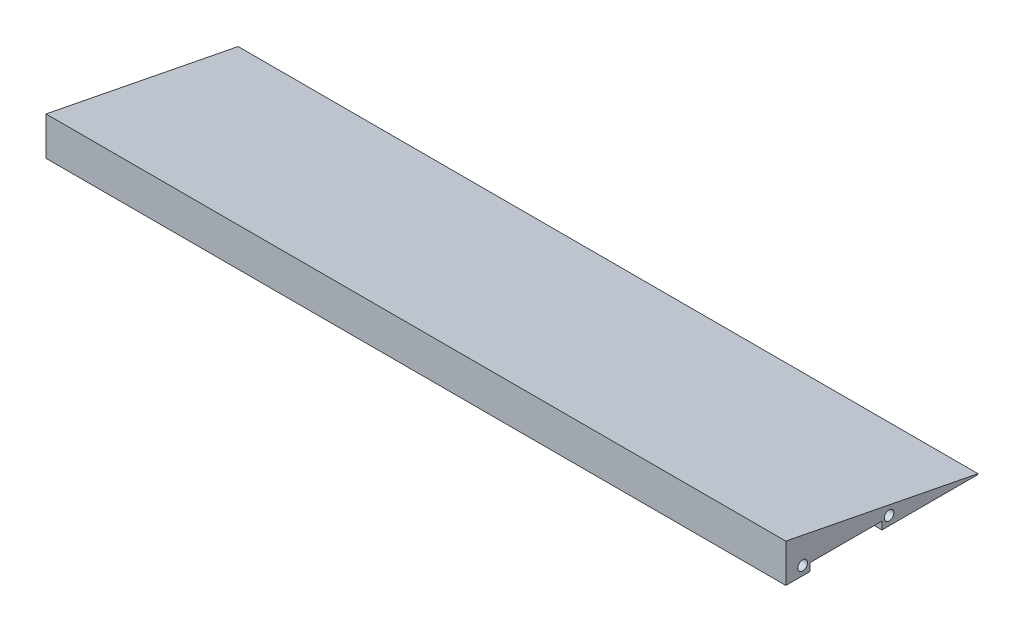
from build123d import *

# Parameters (mm, degrees)
BOSS_EXTRUDE1_DEPTH = 195.58
SKETCH2_R           = 2.5527
CUT_EXTRUDE1_DEPTH  = 38.1
SKETCH3_W           = 38.1
SKETCH3_H           = 4.064
CUT_EXTRUDE2_DEPTH  = 405.649982083
CUT_EXTRUDE3_DEPTH  = 4.064


with BuildPart() as part:
    # Sketch1 → Boss-Extrude1 (new, symmetric)
    with BuildSketch(Plane(origin=(0, 0, 0), x_dir=(0, 0, -1), z_dir=(1, 0, 0))):
        Polygon((0, 0), (0, 20.32), (101.6, 0.4), (101.6, 0), align=None)
    extrude(amount=BOSS_EXTRUDE1_DEPTH, both=True)

    # Sketch2 → Cut-Extrude1 (cut)
    with BuildSketch(Plane(origin=(195.58, 0, 0), x_dir=(0, 0, -1), z_dir=(1, 0, 0))):
        with Locations((8.876362872, 4.7625)):
            Circle(SKETCH2_R)
        with Locations((54.596362872, 4.7625)):
            Circle(SKETCH2_R)
    cut_extrude1 = extrude(amount=-CUT_EXTRUDE1_DEPTH, mode=Mode.SUBTRACT)

    # Mirror3: Cut-Extrude1 across plane
    add(cut_extrude1.mirror(Plane(origin=(0, 0, 0), x_dir=(0, 0, 1), z_dir=(1, 0, 0))), mode=Mode.SUBTRACT)

    # Sketch3 → Cut-Extrude2 (cut, through all)
    with BuildSketch(Plane.ZY.offset(195.58)):
        with Locations((-31.75, 2.032)):
            Rectangle(SKETCH3_W, SKETCH3_H)
    extrude(amount=-CUT_EXTRUDE2_DEPTH, mode=Mode.SUBTRACT)

    # Sketch4 → Cut-Extrude3 (cut)
    with BuildSketch(Plane.XZ):
        Polygon((-144.78, -50.8), (-146.105623787, -60.232303355), (-144.78, -60.232303355), (-128.381247573, -60.232303355), (-127.055623787, -60.232303355), (-128.381247573, -50.8), align=None)
        Polygon((-77.581247573, -50.8), (-78.90687136, -60.232303355), (-77.581247573, -60.232303355), (-61.182495147, -60.232303355), (-59.85687136, -60.232303355), (-61.182495147, -50.8), align=None)
        Polygon((-10.382495147, -50.8), (-11.708118933, -60.232303355), (-10.382495147, -60.232303355), (6.01625728, -60.232303355), (7.341881067, -60.232303355), (6.01625728, -50.8), align=None)
        Polygon((56.81625728, -50.8), (55.490633493, -60.232303355), (56.81625728, -60.232303355), (73.215009707, -60.232303355), (74.540633493, -60.232303355), (73.215009707, -50.8), align=None)
        Polygon((124.015009707, -50.8), (122.68938592, -60.232303355), (124.015009707, -60.232303355), (140.413762134, -60.232303355), (141.73938592, -60.232303355), (140.413762134, -50.8), align=None)
        Polygon((124.015009707, -12.7), (140.413762134, -12.7), (141.73938592, -3.267696645), (140.413762134, -3.267696645), (124.015009707, -3.267696645), (122.68938592, -3.267696645), align=None)
        Polygon((56.81625728, -12.7), (73.215009707, -12.7), (74.540633493, -3.267696645), (73.215009707, -3.267696645), (56.81625728, -3.267696645), (55.490633493, -3.267696645), align=None)
        Polygon((-10.382495147, -12.7), (6.01625728, -12.7), (7.341881067, -3.267696645), (6.01625728, -3.267696645), (-10.382495147, -3.267696645), (-11.708118933, -3.267696645), align=None)
        Polygon((-77.581247573, -12.7), (-61.182495147, -12.7), (-59.85687136, -3.267696645), (-61.182495147, -3.267696645), (-77.581247573, -3.267696645), (-78.90687136, -3.267696645), align=None)
        Polygon((-144.78, -12.7), (-128.381247573, -12.7), (-127.055623787, -3.267696645), (-128.381247573, -3.267696645), (-144.78, -3.267696645), (-146.105623787, -3.267696645), align=None)
    extrude(amount=-CUT_EXTRUDE3_DEPTH, mode=Mode.SUBTRACT)


solid = part.part
